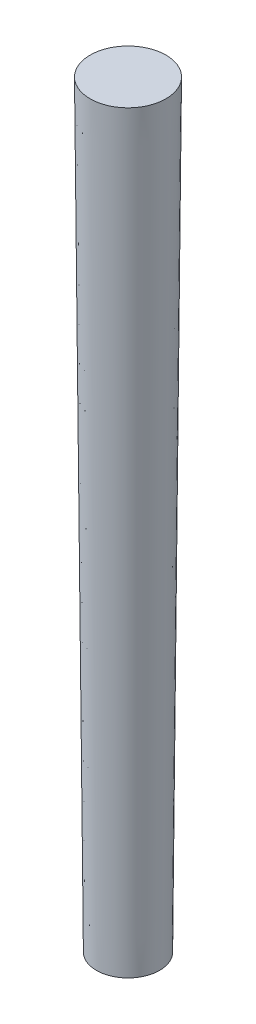
from build123d import *

# Parameters (mm, degrees)
SCALE1_SCALE = 0.33


with BuildPart() as part:
    # Sketch1 → Revolve1 (revolve)
    with BuildSketch(Plane.XY, mode=Mode.PRIVATE) as revolve1_sk:
        Polygon((0, -30), (0, 30), (3, 30), (2.5, -30), align=None)
    revolve(revolve1_sk.sketch.rotate(Axis((0, -30, 0), (0, 1, 0)), 90), axis=Axis((0, -30, 0), (0, 1, 0)))


with BuildPart() as part_1:
    # Scale1: scaled about (0, 1.813186813, 0)
    add(part.part.scale(SCALE1_SCALE).moved(Location((0, 1.214835165, 0))))


solid = part_1.part
